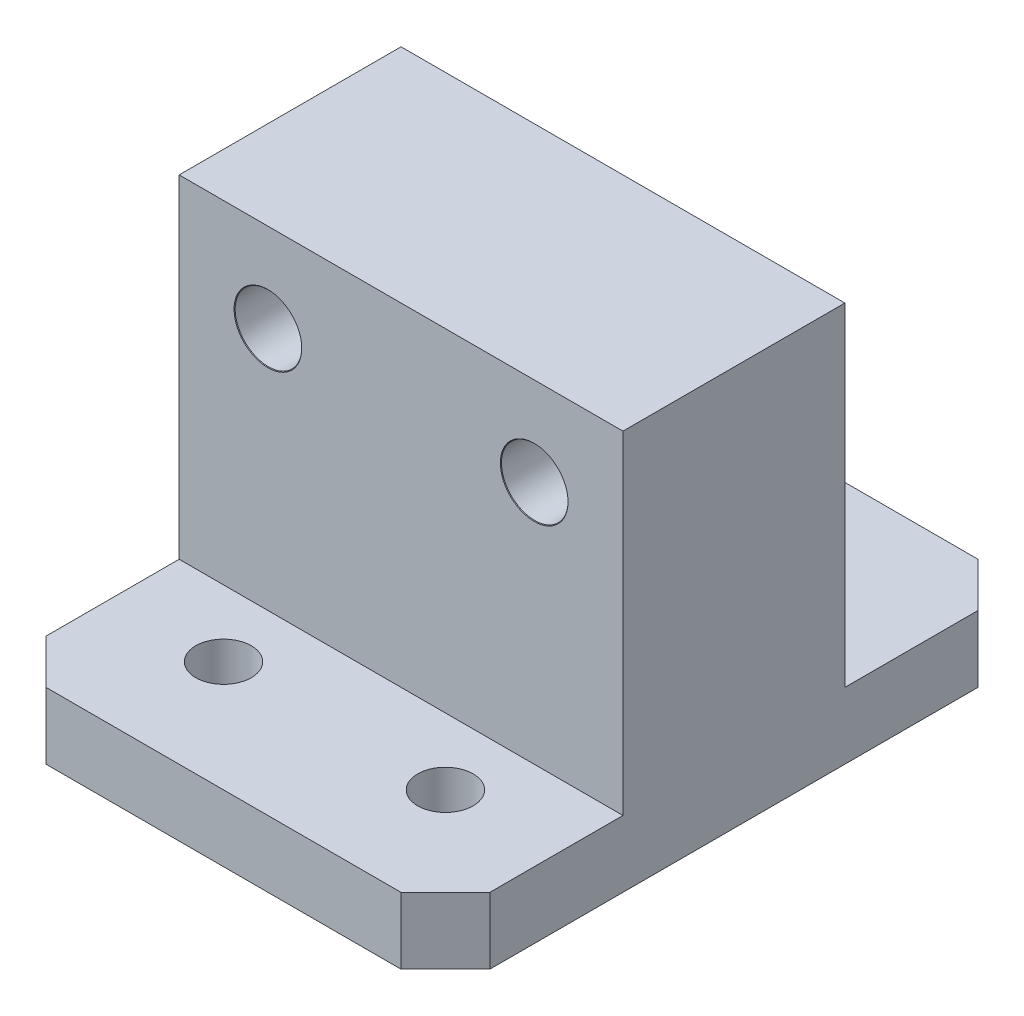
from build123d import *

# Parameters (mm, degrees)
SKETCH_1_W            = 20
SKETCH_1_H            = 15
EXTRUDE_1_DEPTH       = 10
F_3_0MM_1_D           = 3
F_3_0MM_1_CSINK_D     = 3.05
F_3_0MM_1_CSINK_ANGLE = 90
SKETCH_3_W            = 20
SKETCH_3_H            = 26
EXTRUDE_2_DEPTH       = 3
F_2_5MM_1_D           = 2.5
F_2_5MM_1_CSINK_D     = 2.55
F_2_5MM_1_CSINK_ANGLE = 90
CHAMFER_1_SIZE        = 2


with BuildPart() as part:
    # 草图1 → 凸台-拉伸1 (new body)
    with BuildSketch(Plane.XY):
        with Locations((10, 7.5)):
            Rectangle(SKETCH_1_W, SKETCH_1_H)
    extrude(amount=EXTRUDE_1_DEPTH)

    # Ø3.0mm 暗销孔1 (through all)
    with Locations(Plane(origin=(4, 11, 10), x_dir=(1, 0, 0), z_dir=(0, 0, 1))):
        with Locations((0, 0), (12, 0)):
            CounterSinkHole(F_3_0MM_1_D / 2, F_3_0MM_1_CSINK_D / 2, counter_sink_angle=F_3_0MM_1_CSINK_ANGLE)

    # 草图3 → 凸台-拉伸2 (add)
    with BuildSketch(Plane.XZ):
        with Locations((10, 5)):
            Rectangle(SKETCH_3_W, SKETCH_3_H)
    extrude(amount=EXTRUDE_2_DEPTH)

    # Ø2.5mm 暗销孔1 (through all)
    with Locations(Plane(origin=(5, -3, 13), x_dir=(0, 0, -1), z_dir=(0, -1, 0))):
        with Locations((0, 0), (0, 10), (16, 0), (16, 10)):
            CounterSinkHole(F_2_5MM_1_D / 2, F_2_5MM_1_CSINK_D / 2, counter_sink_angle=F_2_5MM_1_CSINK_ANGLE)

    # 倒角1
    chamfer_1_edges = [part.edges().sort_by_distance(p)[0] for p in [
        (20, -1.5, -8),
        (20, -1.5, 18),
        (0, -1.5, 18),
        (0, -1.5, -8),
    ]]
    chamfer(chamfer_1_edges, length=CHAMFER_1_SIZE)


solid = part.part
